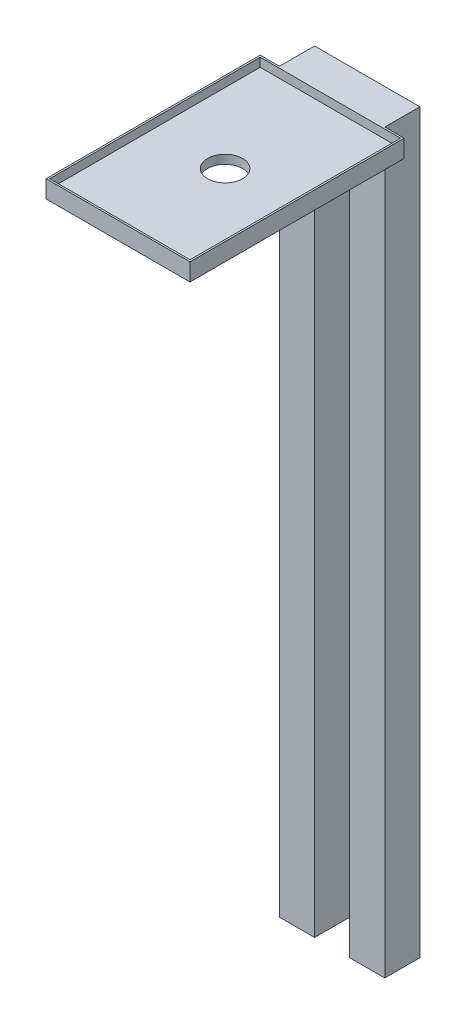
from build123d import *

# Parameters (mm, degrees)
SKETCH1_W           = 40
SKETCH1_H           = 60
SKETCH1_R           = 5
BOSS_EXTRUDE1_DEPTH = 2.5
SKETCH2_W           = 41
SKETCH2_H           = 61
SKETCH2_W_2         = 40
SKETCH2_H_2         = 60
BOSS_EXTRUDE2_DEPTH = 5
SKETCH3_W           = 30
SKETCH3_H           = 10
BOSS_EXTRUDE3_DEPTH = 10
SKETCH4_W           = 10
SKETCH4_H           = 10
BOSS_EXTRUDE4_DEPTH = 200


with BuildPart() as part:
    # Sketch1 → Boss-Extrude1 (new body)
    with BuildSketch(Plane(origin=(0, 0, 0), x_dir=(1, 0, 0), z_dir=(0, 1, 0))):
        Rectangle(SKETCH1_W, SKETCH1_H)
        with Locations(Location((0, 0, 0), (0, 0, 270))):
            Circle(SKETCH1_R, mode=Mode.SUBTRACT)
    extrude(amount=BOSS_EXTRUDE1_DEPTH)

    # Sketch2 → Boss-Extrude2 (add)
    with BuildSketch(Plane.XZ):
        Rectangle(SKETCH2_W, SKETCH2_H)
        Rectangle(SKETCH2_W_2, SKETCH2_H_2, mode=Mode.SUBTRACT)
    extrude(amount=-BOSS_EXTRUDE2_DEPTH)

    # Sketch3 → Boss-Extrude3 (add)
    with BuildSketch(Plane(origin=(0, 0, -30.5), x_dir=(-1, 0, 0), z_dir=(0, 0, -1))):
        Rectangle(SKETCH3_W, SKETCH3_H)
    extrude(amount=BOSS_EXTRUDE3_DEPTH)

    # Sketch4 → Boss-Extrude4 (add)
    with BuildSketch(Plane.XZ.offset(5)):
        with Locations((-10, -35.5)):
            Rectangle(SKETCH4_W, SKETCH4_H)
        with Locations((10, -35.5)):
            Rectangle(SKETCH4_W, SKETCH4_H)
    extrude(amount=BOSS_EXTRUDE4_DEPTH)


solid = part.part
